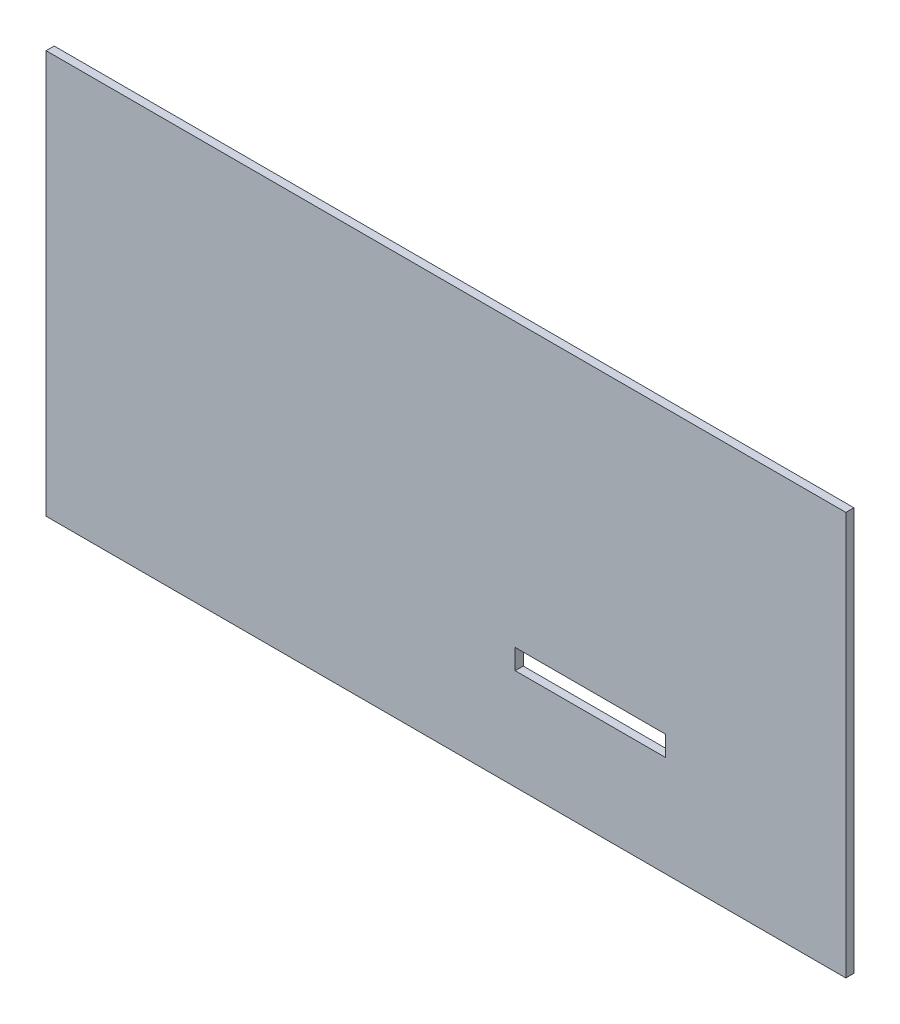
from build123d import *

# Parameters (mm, degrees)
SKETCH_1_W          = 595
SKETCH_1_H          = 300
EXTRUDE_1_DEPTH     = 6
SKETCH_2_W          = 112
SKETCH_2_H          = 15
CUT_EXTRUDE_1_DEPTH = 334.230025658


with BuildPart() as part:
    # Эскиз1 → Бобышка-Вытянуть1 (new body)
    with BuildSketch(Plane.XY):
        Rectangle(SKETCH_1_W, SKETCH_1_H)
    extrude(amount=EXTRUDE_1_DEPTH)

    # Эскиз2 → Вырез-Вытянуть1 (cut, through all)
    with BuildSketch(Plane.XY.offset(6)):
        with Locations((107.5, -67.5)):
            Rectangle(SKETCH_2_W, SKETCH_2_H)
    extrude(amount=-CUT_EXTRUDE_1_DEPTH, mode=Mode.SUBTRACT)


solid = part.part
